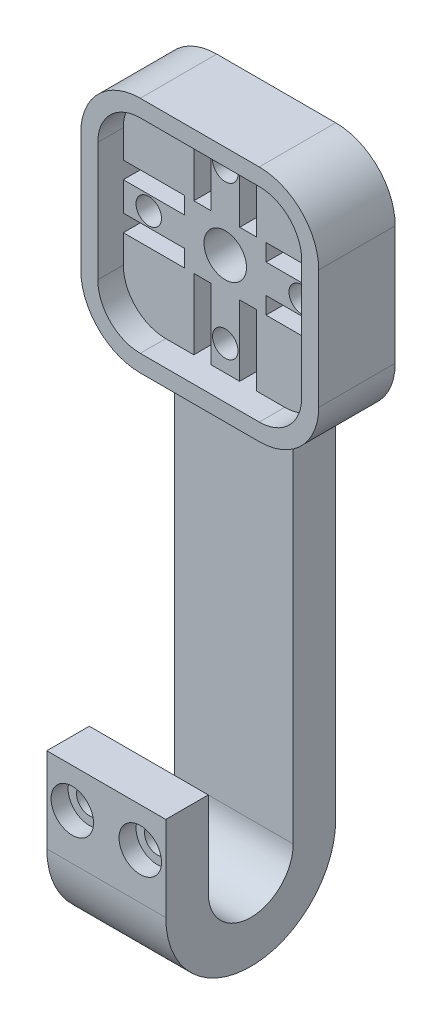
from build123d import *

# Parameters (mm, degrees)
Y_KSEKLIK_EKSTR_ZYON1_DEPTH = 9
Y_KSEKLIK_EKSTR_ZYON2_DEPTH = 6
IZIM4_R                     = 1.5
IZIM4_R_2                   = 2.5
KES_EKSTR_ZYON2_DEPTH       = 6.5
IZIM5_W                     = 14
IZIM5_H                     = 15
Y_KSEKLIK_EKSTR_ZYON3_DEPTH = 5
Y_KSEKLIK_EKSTR_ZYON4_DEPTH = 7
IZIM3_W                     = 7.2
IZIM3_H                     = 2
IZIM3_W_2                   = 2
IZIM3_H_2                   = 8.3
KES_EKSTR_ZYON3_DEPTH       = 3
IZIM8_R                     = 1.5
KES_EKSTR_ZYON5_DEPTH       = 10
IZIM9_R                     = 2.5
IZIM9_R_2                   = 4
KES_EKSTR_ZYON6_DEPTH       = 2
IZIM10_R                    = 2.5
KES_EKSTR_ZYON7_DEPTH       = 2
KES_EKSTR_ZYON8_START       = -10
KES_EKSTR_ZYON8_DEPTH       = 10
IZIM12_W                    = 14
IZIM12_H                    = 3
Y_KSEKLIK_EKSTR_ZYON5_DEPTH = 5


with BuildPart() as part:
    # Çizim1 → Yükseklik-Ekstrüzyon1 (new body)
    with BuildSketch(Plane.XY):
        with BuildLine():
            Line((17, 7), (17, -7))
            ThreePointArc((17, -7), (14.071067812, -14.071067812), (7, -17))
            Line((7, -17), (-7, -17))
            ThreePointArc((-7, -17), (-14.071067812, -14.071067812), (-17, -7))
            Line((-17, -7), (-17, 7))
            ThreePointArc((-17, 7), (-14.071067812, 14.071067812), (-7, 17))
            Line((-7, 17), (7, 17))
            ThreePointArc((7, 17), (14.071067812, 14.071067812), (17, 7))
        make_face()
        with BuildLine():
            Line((-7, 12), (7, 12))
            ThreePointArc((7, 12), (10.535533906, 10.535533906), (12, 7))
            Line((12, 7), (12, -7))
            ThreePointArc((12, -7), (10.535533906, -10.535533906), (7, -12))
            Line((7, -12), (-7, -12))
            ThreePointArc((-7, -12), (-10.535533906, -10.535533906), (-12, -7))
            Line((-12, -7), (-12, 7))
            ThreePointArc((-12, 7), (-10.535533906, 10.535533906), (-7, 12))
        make_face(mode=Mode.SUBTRACT)
    extrude(amount=Y_KSEKLIK_EKSTR_ZYON1_DEPTH)

    # Çizim2 → Yükseklik-Ekstrüzyon2 (add)
    with BuildSketch(Plane.XY):
        with BuildLine():
            Line((-7, -12), (7, -12))
            ThreePointArc((7, -12), (10.535533906, -10.535533906), (12, -7))
            Line((12, -7), (12, 7))
            ThreePointArc((12, 7), (10.535533906, 10.535533906), (7, 12))
            Line((7, 12), (-7, 12))
            ThreePointArc((-7, 12), (-10.535533906, 10.535533906), (-12, 7))
            Line((-12, 7), (-12, -7))
            ThreePointArc((-12, -7), (-10.535533906, -10.535533906), (-7, -12))
        make_face()
    extrude(amount=Y_KSEKLIK_EKSTR_ZYON2_DEPTH)

    # Çizim4 → Kes-Ekstrüzyon2 (cut)
    with BuildSketch(Plane.XY.offset(6)):
        with Locations((0, 9)):
            Circle(IZIM4_R)
        Circle(IZIM4_R_2)
        with Locations((9, 0)):
            Circle(IZIM4_R)
        with Locations((0, -9)):
            Circle(IZIM4_R)
        with Locations((-9, 0)):
            Circle(IZIM4_R)
    extrude(amount=-KES_EKSTR_ZYON2_DEPTH, mode=Mode.SUBTRACT)

    # Çizim5 → Yükseklik-Ekstrüzyon3 (add)
    with BuildSketch(Plane.XY):
        with Locations((0, -24.5)):
            Rectangle(IZIM5_W, IZIM5_H)
    extrude(amount=Y_KSEKLIK_EKSTR_ZYON3_DEPTH)

    # Çizim6 → Yükseklik-Ekstrüzyon4 (add, symmetric)
    with BuildSketch(Plane(origin=(0, 0, 0), x_dir=(0, 0, -1), z_dir=(1, 0, 0))):
        with BuildLine():
            Line((0, -32), (-5, -32))
            Line((-5, -32), (-5, -57))
            ThreePointArc((-5, -57), (-10, -62), (-15, -57))
            Line((-15, -57), (-15, -47))
            Line((-15, -47), (-20, -47))
            Line((-20, -47), (-20, -57))
            ThreePointArc((-20, -57), (-10, -67), (0, -57))
            Line((0, -57), (0, -32))
        make_face()
    extrude(amount=Y_KSEKLIK_EKSTR_ZYON4_DEPTH, both=True)

    # Çizim3 → Kes-Ekstrüzyon3 (cut)
    with BuildSketch(Plane.XY.offset(6)):
        with Locations((8.4, 2.7)):
            Rectangle(IZIM3_W, IZIM3_H)
        with Locations((2.7, 7.85)):
            Rectangle(IZIM3_W_2, IZIM3_H_2)
        with Locations((-2.7, 7.85)):
            Rectangle(IZIM3_W_2, IZIM3_H_2)
        with Locations((-8.4, 2.7)):
            Rectangle(IZIM3_W, IZIM3_H)
        with Locations((-8.4, -2.7)):
            Rectangle(IZIM3_W, IZIM3_H)
        with Locations((-2.7, -7.85)):
            Rectangle(IZIM3_W_2, IZIM3_H_2)
        with Locations((2.7, -7.85)):
            Rectangle(IZIM3_W_2, IZIM3_H_2)
        with Locations((8.4, -2.7)):
            Rectangle(IZIM3_W, IZIM3_H)
    extrude(amount=-KES_EKSTR_ZYON3_DEPTH, mode=Mode.SUBTRACT)

    # Çizim8 → Kes-Ekstrüzyon5 (cut)
    with BuildSketch(Plane.XY.offset(20)):
        with Locations((-4, -51.616632033)):
            Circle(IZIM8_R)
        with Locations((4, -51.616632033)):
            Circle(IZIM8_R)
    extrude(amount=-KES_EKSTR_ZYON5_DEPTH, mode=Mode.SUBTRACT)

    # Çizim9 → Kes-Ekstrüzyon6 (cut)
    with BuildSketch(Plane(origin=(0, 0, 0), x_dir=(-1, 0, 0), z_dir=(0, 0, -1))):
        with Locations((0, 9)):
            Circle(IZIM9_R)
        Circle(IZIM9_R_2)
        with Locations((9, 0)):
            Circle(IZIM9_R)
        with Locations((0, -9)):
            Circle(IZIM9_R)
        with Locations((-9, 0)):
            Circle(IZIM9_R)
    extrude(amount=-KES_EKSTR_ZYON6_DEPTH, mode=Mode.SUBTRACT)

    # Çizim10 → Kes-Ekstrüzyon7 (cut)
    with BuildSketch(Plane.XY.offset(20)):
        with Locations((-4, -51.616632033)):
            Circle(IZIM10_R)
        with Locations((4, -51.616632033)):
            Circle(IZIM10_R)
    extrude(amount=-KES_EKSTR_ZYON7_DEPTH, mode=Mode.SUBTRACT)

    # Çizim11 → Kes-Ekstrüzyon8 (cut)
    with BuildSketch(Plane.XY.offset(9).offset(KES_EKSTR_ZYON8_START)):
        with BuildLine():
            Line((7, 17), (-7, 17))
            ThreePointArc((-7, 17), (-14.071067812, 14.071067812), (-17, 7))
            Line((-17, 7), (-17, -7))
            ThreePointArc((-17, -7), (-14.071067812, -14.071067812), (-7, -17))
            Line((-7, -17), (7, -17))
            ThreePointArc((7, -17), (14.071067812, -14.071067812), (17, -7))
            Line((17, -7), (17, 7))
            ThreePointArc((17, 7), (14.071067812, 14.071067812), (7, 17))
        make_face()
        with BuildLine():
            Line((7, 14), (-7, 14))
            ThreePointArc((-7, 14), (-11.949747468, 11.949747468), (-14, 7))
            Line((-14, 7), (-14, -7))
            ThreePointArc((-14, -7), (-11.949747468, -11.949747468), (-7, -14))
            Line((-7, -14), (7, -14))
            ThreePointArc((7, -14), (11.949747468, -11.949747468), (14, -7))
            Line((14, -7), (14, 7))
            ThreePointArc((14, 7), (11.949747468, 11.949747468), (7, 14))
        make_face(mode=Mode.SUBTRACT)
    extrude(amount=KES_EKSTR_ZYON8_DEPTH, mode=Mode.SUBTRACT)


with BuildPart() as kes_ekstr_zyon8_piece_1:
    # of the separate pieces the step leaves, piece 1, a body of its own (kes_ekstr_zyon8_pieces)
    add(part.part.solids().sort_by_distance((-7, -57, 0))[0])



with BuildPart() as kes_ekstr_zyon8_piece_2:
    # of the separate pieces the step leaves, piece 2, a body of its own (kes_ekstr_zyon8_pieces)
    add(part.part.solids().sort_by_distance((7, 14, 0))[0])


with BuildPart() as kes_ekstr_zyon8_piece_1_1:
    add(kes_ekstr_zyon8_piece_1.part)

    add(kes_ekstr_zyon8_piece_2.part)  # Yükseklik-Ekstrüzyon5 merges Kes-Ekstrüzyon8 piece 2
    # Çizim12 → Yükseklik-Ekstrüzyon5 (add)
    with BuildSketch(Plane.XY):
        with Locations((0, -15.5)):
            Rectangle(IZIM12_W, IZIM12_H)
    extrude(amount=Y_KSEKLIK_EKSTR_ZYON5_DEPTH)


solid = kes_ekstr_zyon8_piece_1_1.part
